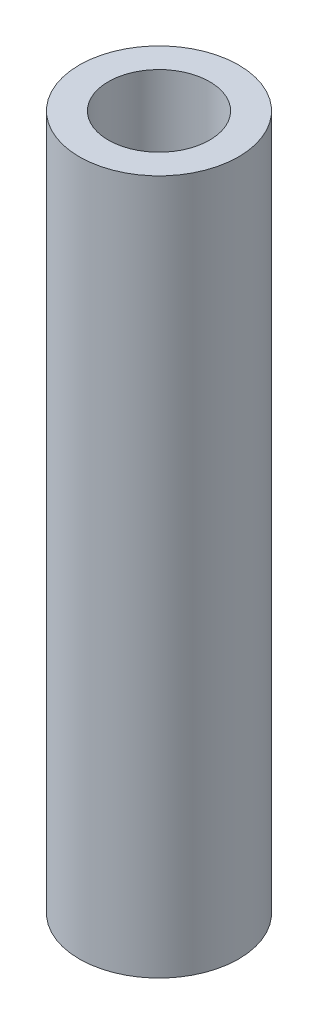
from build123d import *

# Parameters (mm, degrees)
SKETCH_1_R      = 2.75
SKETCH_1_R_2    = 1.75
EXTRUDE_1_DEPTH = 24


with BuildPart() as part:
    # 草图1 → 凸台-拉伸1 (new body)
    with BuildSketch(Plane(origin=(0, 0, 0), x_dir=(1, 0, 0), z_dir=(0, 1, 0))):
        with Locations(Location((0, 0, 0), (0, 0, 270))):
            Circle(SKETCH_1_R)
        with Locations(Location((0, 0, 0), (0, 0, 270))):
            Circle(SKETCH_1_R_2, mode=Mode.SUBTRACT)
    extrude(amount=EXTRUDE_1_DEPTH)


solid = part.part
